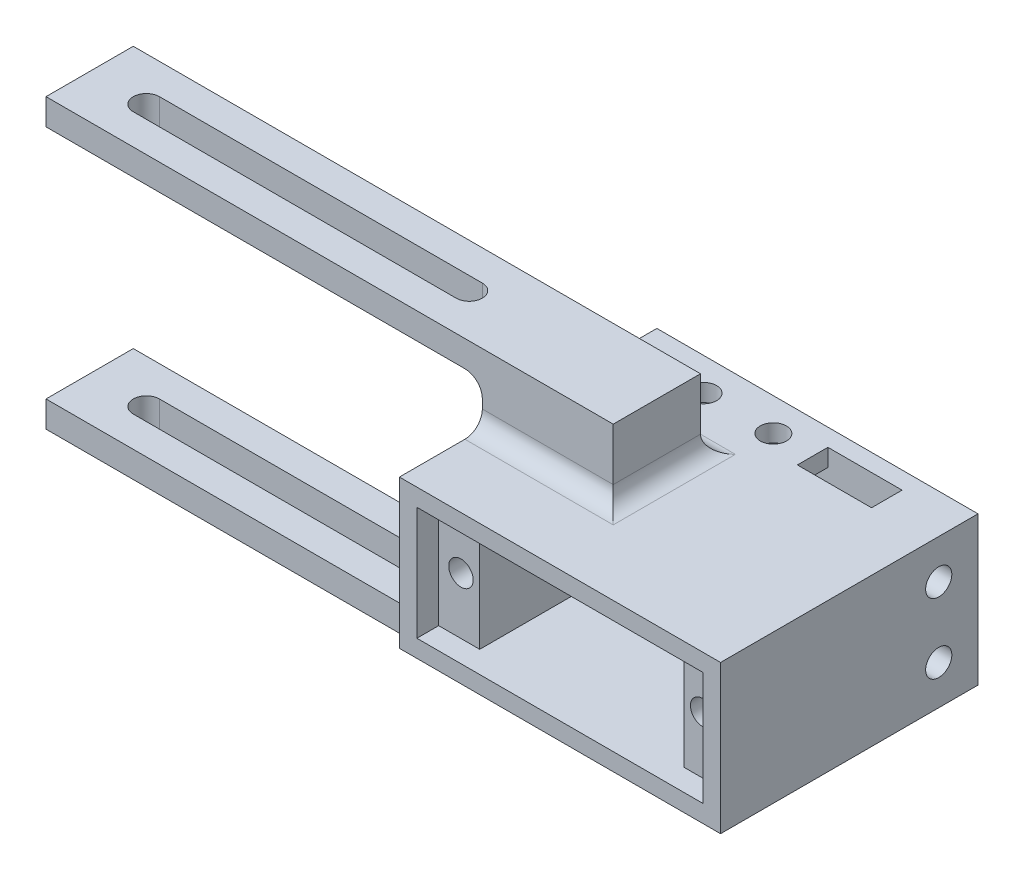
from build123d import *

# Parameters (mm, degrees)
SKETCH1_R                = 1.4
BOSS_EXTRUDE1_DEPTH      = 2
BOSS_EXTRUDE1_2_DEPTH    = 2
BOSS_EXTRUDE3_DEPTH      = 2.5
BOSS_EXTRUDE3_DEPTH_BACK = 25
SKETCH4_W                = 36.8
SKETCH4_H                = 17
BOSS_EXTRUDE4_START      = 23
SKETCH5_W                = 4.7
SKETCH5_H                = 13
SKETCH5_R                = 1.4
BOSS_EXTRUDE4_DEPTH      = 23
SKETCH6_W                = 36.8
SKETCH6_H                = 17
BOSS_EXTRUDE5_DEPTH      = 2
SKETCH7_R                = 1.5
SKETCH7_W                = 8.5
SKETCH7_H                = 3.5
CUT_EXTRUDE1_DEPTH       = 36.391524409
SKETCH8_R                = 1.5
CUT_EXTRUDE2_DEPTH       = 46.293376999
CUT_EXTRUDE3_DEPTH       = 36.791898525
BOSS_EXTRUDE6_DEPTH      = 10
CUT_EXTRUDE4_DEPTH       = 79.762681519
CUT_EXTRUDE4_DEPTH_BACK  = 79.762681519
FILLET1_R                = 2


with BuildPart() as part:
    # Sketch1 → Boss-Extrude1 (new body)
    with BuildSketch(Plane.XY):
        Polygon((-11.7, -6.5), (-11.7, 0), (-11.7, 6.5), (-16.4, 6.5), (-16.4, -6.5), align=None)
        with Locations((-13.85, 0)):
            Circle(SKETCH1_R, mode=Mode.SUBTRACT)
    extrude(amount=BOSS_EXTRUDE1_DEPTH)



with BuildPart() as body_2:
    # Sketch1 → Boss-Extrude1 2 (new body)
    with BuildSketch(Plane.XY):
        Polygon((11.7, 6.5), (11.7, 0), (11.7, -6.5), (16.4, -6.5), (16.4, 6.5), align=None)
        with Locations((13.85, 0)):
            Circle(SKETCH1_R, mode=Mode.SUBTRACT)
    extrude(amount=BOSS_EXTRUDE1_2_DEPTH)


with BuildPart() as part_1:
    add(part.part)

    add(body_2.part)  # Boss-Extrude3 merges body 2
    # Sketch4 → Boss-Extrude3 (add, two sides: drawn at the far end of the back side and taken through both)
    with BuildSketch(Plane.XY.offset(2).offset(-BOSS_EXTRUDE3_DEPTH_BACK)):
        Rectangle(SKETCH4_W, SKETCH4_H)
        Polygon((-16.4, 6.5), (-11.7, 6.5), (11.7, 6.5), (16.4, 6.5), (16.4, -6.5), (11.7, -6.5), (-11.7, -6.5), (-16.4, -6.5), align=None, mode=Mode.SUBTRACT)
    extrude(amount=BOSS_EXTRUDE3_DEPTH + BOSS_EXTRUDE3_DEPTH_BACK)

    # Sketch5 → Boss-Extrude4 (add)
    # profile 1 of 2: a face of its own
    with BuildSketch(Plane(origin=(0, 0, 0), x_dir=(-1, 0, 0), z_dir=(0, 0, -1)).offset(BOSS_EXTRUDE4_START)):
        with Locations((-14.05, 0)):
            Rectangle(SKETCH5_W, SKETCH5_H)
        with Locations(Location((-13.85, 0, 0), (0, 0, 180))):
            Circle(SKETCH5_R, mode=Mode.SUBTRACT)
    # profile 2 of 2: a face of its own
    with BuildSketch(Plane(origin=(0, 0, 0), x_dir=(-1, 0, 0), z_dir=(0, 0, -1)).offset(BOSS_EXTRUDE4_START)):
        with Locations((14.05, 0)):
            Rectangle(SKETCH5_W, SKETCH5_H)
        with Locations(Location((13.85, 0, 0), (0, 0, 180))):
            Circle(SKETCH5_R, mode=Mode.SUBTRACT)
    extrude(amount=-BOSS_EXTRUDE4_DEPTH)

    # Sketch6 → Boss-Extrude5 (add)
    with BuildSketch(Plane(origin=(0, 0, -23), x_dir=(-1, 0, 0), z_dir=(0, 0, -1))):
        Rectangle(SKETCH6_W, SKETCH6_H)
    extrude(amount=BOSS_EXTRUDE5_DEPTH)

    # Sketch7 → Cut-Extrude1 (cut, through all)
    with BuildSketch(Plane(origin=(0, 8.5, 0), x_dir=(1, 0, 0), z_dir=(0, 1, 0))):
        with Locations(Location((-1.300147184, 21.25, 0), (0, 0, 270))):
            Circle(SKETCH7_R)
        with Locations(Location((-9.300147184, 21.25, 0), (0, 0, 270))):
            Circle(SKETCH7_R)
        with Locations((7.45, 21.25)):
            Rectangle(SKETCH7_W, SKETCH7_H)
    extrude(amount=-CUT_EXTRUDE1_DEPTH, mode=Mode.SUBTRACT)

    # Sketch8 → Cut-Extrude2 (cut, through all)
    with BuildSketch(Plane(origin=(18.4, 0, 0), x_dir=(0, 0, -1), z_dir=(1, 0, 0))):
        with Locations(Location((20.5, 4, 0), (0, 0, 90))):
            Circle(SKETCH8_R)
        with Locations((20.5, -4)):
            Circle(SKETCH8_R)
    extrude(amount=-CUT_EXTRUDE2_DEPTH, mode=Mode.SUBTRACT)

    # Sketch9 → Cut-Extrude3 (cut, through all)
    with BuildSketch(Plane(origin=(0, 0, -25), x_dir=(-1, 0, 0), z_dir=(0, 0, -1))):
        with BuildLine():
            Line((8.9, -1.5), (-8.9, -1.5))
            ThreePointArc((-8.9, -1.5), (-10.4, 0), (-8.9, 1.5))
            Line((-8.9, 1.5), (8.9, 1.5))
            ThreePointArc((8.9, 1.5), (10.4, 0), (8.9, -1.5))
        make_face()
    extrude(amount=-CUT_EXTRUDE3_DEPTH, mode=Mode.SUBTRACT)

    # Sketch10 → Boss-Extrude6 (add)
    with BuildSketch(Plane(origin=(0, 0, -15), x_dir=(-1, 0, 0), z_dir=(0, 0, -1))):
        Polygon((68.4, -13.5), (18.4, -13.5), (18.4, -8.5), (3.4, -8.5), (3.4, -16.5), (68.4, -16.5), align=None)
        Polygon((3.4, 8.5), (18.4, 8.5), (18.4, 13.5), (68.4, 13.5), (68.4, 16.5), (3.4, 16.5), align=None)
    extrude(amount=-BOSS_EXTRUDE6_DEPTH)

    # Sketch12 → Cut-Extrude4 (cut, two sides: drawn at the far end of the back side and taken through both)
    with BuildSketch(Plane(origin=(0, -13.5, 0), x_dir=(1, 0, 0), z_dir=(0, 1, 0)).offset(-CUT_EXTRUDE4_DEPTH_BACK)):
        with BuildLine():
            Line((-24.9, 8.5), (-61.9, 8.5))
            ThreePointArc((-61.9, 8.5), (-63.4, 10), (-61.9, 11.5))
            Line((-61.9, 11.5), (-24.9, 11.5))
            ThreePointArc((-24.9, 11.5), (-23.4, 10), (-24.9, 8.5))
        make_face()
    extrude(amount=CUT_EXTRUDE4_DEPTH + CUT_EXTRUDE4_DEPTH_BACK, mode=Mode.SUBTRACT)

    # Fillet1
    fillet1_edges = [part_1.edges().sort_by_distance(p)[0] for p in [
        (-3.4, 8.5, -10),
        (-18.4, 13.5, -10),
        (-10.9, 8.5, -5),
        (-10.9, 8.5, -15),
        (-10.9, -8.5, -15),
        (-3.4, -8.5, -10),
        (-10.9, -8.5, -5),
        (-18.4, -13.5, -10),
    ]]
    fillet(fillet1_edges, radius=FILLET1_R)


solid = part_1.part
